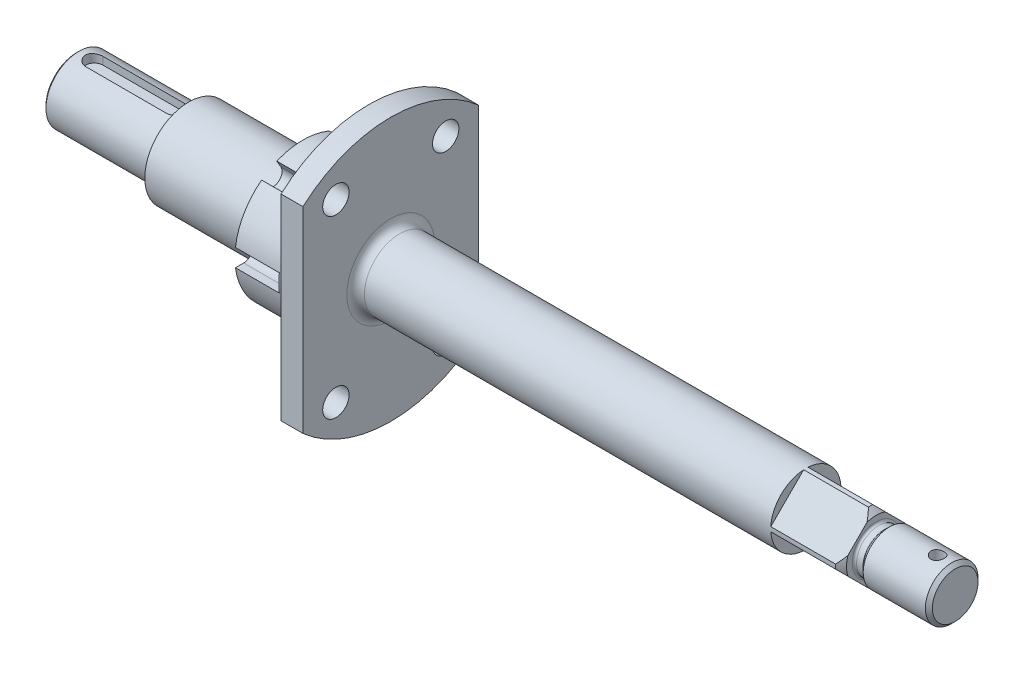
from build123d import *

# Parameters (mm, degrees)
SKETCH_2_OUTSIDE_W       = 208.902
SKETCH_2_OUTSIDE_H       = 208.902
CUT_EXTRUDE_1_DEPTH      = 68
CUT_EXTRUDE_2_DEPTH      = 4
CUT_EXTRUDE_4_DEPTH      = 409.900966005
CUT_EXTRUDE_4_DEPTH_BACK = 409.900966005
SKETCH_6_R               = 3
SKETCH_7_R               = 6
CUT_EXTRUDE_5_DEPTH      = 271.645524626
SKETCH_8_OUTSIDE_W       = 208.902
SKETCH_8_OUTSIDE_H       = 208.902
SKETCH_8_OUTSIDE_W_2     = 80
SKETCH_8_OUTSIDE_H_2     = 120
CUT_EXTRUDE_6_DEPTH      = 271.645524626
CUT_EXTRUDE_3_DEPTH      = 20
PATTERN_CIRCULAR_1_COUNT = 6


with BuildPart() as part:
    # Эскиз1 → Повернуть1 (revolve)
    with BuildSketch(Plane.XY, mode=Mode.PRIVATE) as revolve_1_sk:
        with BuildLine():
            Line((129, 31), (103, 31))
            Line((103, 31), (103, 20))
            Line((103, 20), (51, 20))
            Line((51, 20), (51, 15))
            Line((51, 15), (1, 15))
            Line((1, 15), (0, 14))
            Line((0, 14), (0, 0))
            Line((0, 0), (400, 0))
            Line((400, 0), (400, 10.4))
            Line((400, 10.4), (398.4, 12))
            Line((398.4, 12), (370.1, 12))
            Line((370.1, 12), (368.146446609, 10.046446609))
            ThreePointArc((368.146446609, 10.046446609), (367.984234935, 9.938060234), (367.792893219, 9.9))
            Line((367.792893219, 9.9), (365, 9.9))
            ThreePointArc((365, 9.9), (364.292893219, 10.192893219), (364, 10.9))
            Line((364, 10.9), (364, 13.5))
            Line((364, 13.5), (361.5, 16))
            Line((361.5, 16), (147, 16))
            ThreePointArc((147, 16), (144.171572875, 17.171572875), (143, 20))
            Line((143, 20), (143, 60))
            Line((143, 60), (133, 60))
            Line((133, 60), (133, 35))
            ThreePointArc((133, 35), (131.828427125, 32.171572875), (129, 31))
        make_face()
    revolve(revolve_1_sk.sketch.rotate(Axis((0, 0, 0), (1, 0, 0)), 90), axis=Axis((0, 0, 0), (1, 0, 0)))

    # Эскиз2 outside → Вырез-Вытянуть1 (cut)
    with BuildSketch(Plane(origin=(400, 0, 0), x_dir=(0, 0, -1), z_dir=(1, 0, 0))):
        Rectangle(SKETCH_2_OUTSIDE_W, SKETCH_2_OUTSIDE_H)
        Polygon((0, -16.970562748), (16.970562748, 0), (0, 16.970562748), (-16.970562748, 0), align=None, mode=Mode.SUBTRACT)
    extrude(amount=-CUT_EXTRUDE_1_DEPTH, mode=Mode.SUBTRACT)

    # Эскиз3 → Вырез-Вытянуть2 (cut)
    with BuildSketch(Plane(origin=(0, 15, 0), x_dir=(1, 0, 0), z_dir=(0, 1, 0))):
        with BuildLine():
            Line((8, 4), (45, 4))
            ThreePointArc((45, 4), (49, 0), (45, -4))
            Line((45, -4), (8, -4))
            ThreePointArc((8, -4), (4, 0), (8, 4))
        make_face()
    extrude(amount=-CUT_EXTRUDE_2_DEPTH, mode=Mode.SUBTRACT)

    # Эскиз6 → Вырез-Вытянуть4 (cut, two sides: drawn at the far end of the back side and taken through both)
    with BuildSketch(Plane(origin=(0, 0, 0), x_dir=(1, 0, 0), z_dir=(0, 1, 0)).offset(-CUT_EXTRUDE_4_DEPTH_BACK)):
        with Locations(Location((392, 0, 0), (0, 0, 270))):
            Circle(SKETCH_6_R)
    extrude(amount=CUT_EXTRUDE_4_DEPTH + CUT_EXTRUDE_4_DEPTH_BACK, mode=Mode.SUBTRACT)

    # Эскиз7 → Вырез-Вытянуть5 (cut, through all)
    with BuildSketch(Plane(origin=(143, 0, 0), x_dir=(0, 0, -1), z_dir=(1, 0, 0))):
        with Locations((-25, 40)):
            Circle(SKETCH_7_R)
        with Locations((-25, -40)):
            Circle(SKETCH_7_R)
        with Locations((25, -40)):
            Circle(SKETCH_7_R)
        with Locations((25, 40)):
            Circle(SKETCH_7_R)
    extrude(amount=-CUT_EXTRUDE_5_DEPTH, mode=Mode.SUBTRACT)

    # Эскиз8 outside → Вырез-Вытянуть6 (cut, through all)
    with BuildSketch(Plane(origin=(143, 0, 0), x_dir=(0, 0, -1), z_dir=(1, 0, 0))):
        Rectangle(SKETCH_8_OUTSIDE_W, SKETCH_8_OUTSIDE_H)
        Rectangle(SKETCH_8_OUTSIDE_W_2, SKETCH_8_OUTSIDE_H_2, mode=Mode.SUBTRACT)
    extrude(amount=-CUT_EXTRUDE_6_DEPTH, mode=Mode.SUBTRACT)

    # Эскиз4 → Вырез-Вытянуть3 (cut)
    with BuildSketch(Plane.ZY.offset(-103)):
        with BuildLine():
            Line((30.740852298, 4), (27, 4))
            ThreePointArc((27, 4), (23, 0), (27, -4))
            Line((27, -4), (30.740852298, -4))
            ThreePointArc((30.740852298, -4), (31, 0), (30.740852298, 4))
        make_face()
    cut_extrude_3 = extrude(amount=-CUT_EXTRUDE_3_DEPTH, mode=Mode.SUBTRACT)

    # Круговой массив1: Вырез-Вытянуть3 ×6 about axis
    pattern_circular_1_axis = Axis((0, 0, 0), (1, 0, 0))
    for i in range(1, PATTERN_CIRCULAR_1_COUNT):
        add(cut_extrude_3.rotate(pattern_circular_1_axis, i * 360 / PATTERN_CIRCULAR_1_COUNT), mode=Mode.SUBTRACT)


solid = part.part
